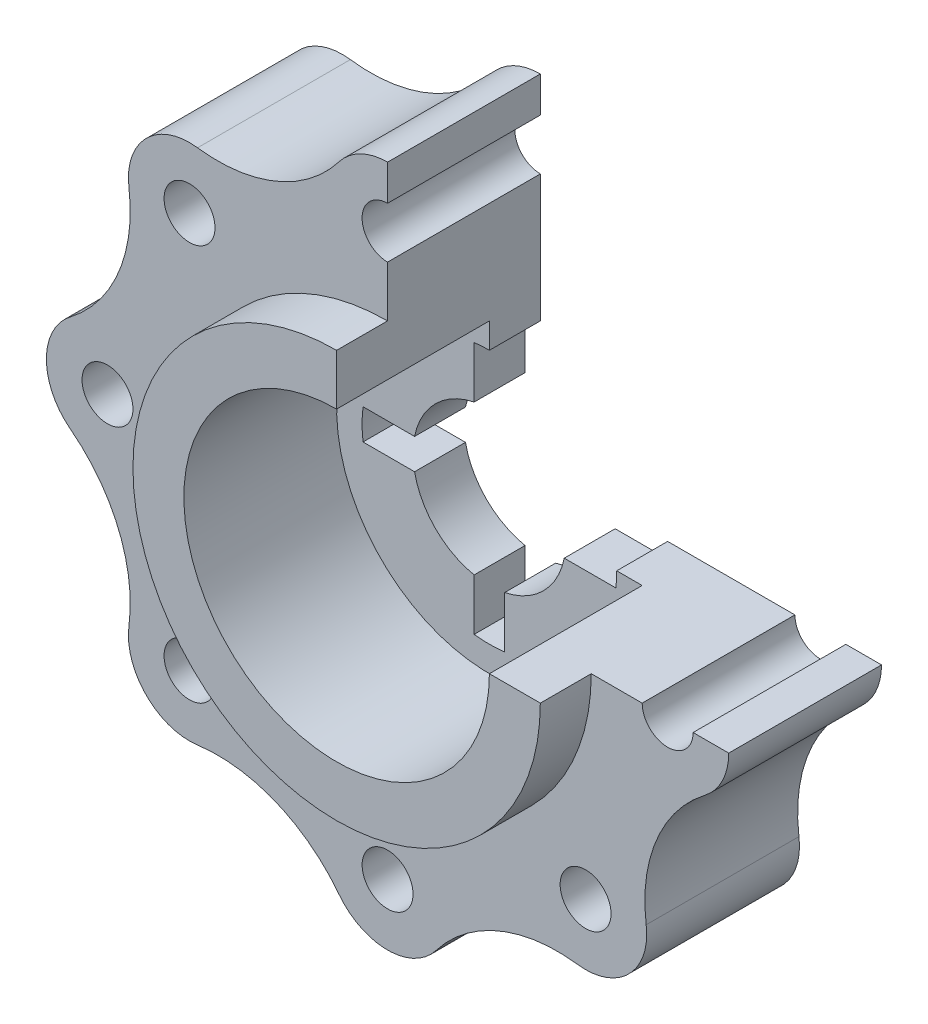
from build123d import *

# Parameters (mm, degrees)
SKETCH2_R           = 5
SKETCH2_R_2         = 40
BOSS_EXTRUDE1_DEPTH = 30
SKETCH2_4_R         = 40
SKETCH2_4_R_2       = 30
BOSS_EXTRUDE2_DEPTH = 40
SKETCH2_5_R         = 30
BOSS_EXTRUDE3_DEPTH = 10
SKETCH3_W           = 75
SKETCH3_H           = 75
CUT_EXTRUDE1_DEPTH  = 40


with BuildPart() as part:
    # Sketch2 → Boss-Extrude1 (new body)
    with BuildSketch(Plane.XY):
        with BuildLine():
            ThreePointArc((-50.786151046, 37.308988209), (-52.807960272, 21.873773346), (-62.292670356, 9.529793233))
            ThreePointArc((-62.292670356, 9.529793233), (-67, 0), (-62.292670356, -9.529793233))
            ThreePointArc((-62.292670356, -9.529793233), (-52.807960272, -21.873773346), (-50.786151046, -37.308988209))
            ThreePointArc((-50.786151046, -37.308988209), (-47.376154339, -47.376154339), (-37.308988209, -50.786151046))
            ThreePointArc((-37.308988209, -50.786151046), (-21.873773346, -52.807960272), (-9.529793233, -62.292670356))
            ThreePointArc((-9.529793233, -62.292670356), (0, -67), (9.529793233, -62.292670356))
            ThreePointArc((9.529793233, -62.292670356), (21.873773346, -52.807960272), (37.308988209, -50.786151046))
            ThreePointArc((37.308988209, -50.786151046), (47.376154339, -47.376154339), (50.786151046, -37.308988209))
            ThreePointArc((50.786151046, -37.308988209), (52.807960272, -21.873773346), (62.292670356, -9.529793233))
            ThreePointArc((62.292670356, -9.529793233), (67, 0), (62.292670356, 9.529793233))
            ThreePointArc((62.292670356, 9.529793233), (52.807960272, 21.873773346), (50.786151046, 37.308988209))
            ThreePointArc((50.786151046, 37.308988209), (47.376154339, 47.376154339), (37.308988209, 50.786151046))
            ThreePointArc((37.308988209, 50.786151046), (21.873773346, 52.807960272), (9.529793233, 62.292670356))
            ThreePointArc((9.529793233, 62.292670356), (0, 67), (-9.529793233, 62.292670356))
            ThreePointArc((-9.529793233, 62.292670356), (-21.873773346, 52.807960272), (-37.308988209, 50.786151046))
            ThreePointArc((-37.308988209, 50.786151046), (-47.376154339, 47.376154339), (-50.786151046, 37.308988209))
        make_face()
        with Locations((-38.890872965, -38.890872965)):
            Circle(SKETCH2_R, mode=Mode.SUBTRACT)
        with Locations((0, -55)):
            Circle(SKETCH2_R, mode=Mode.SUBTRACT)
        with Locations((-55, 0)):
            Circle(SKETCH2_R, mode=Mode.SUBTRACT)
        with Locations((38.890872965, -38.890872965)):
            Circle(SKETCH2_R, mode=Mode.SUBTRACT)
        Circle(SKETCH2_R_2, mode=Mode.SUBTRACT)
        with Locations((55, 0)):
            Circle(SKETCH2_R, mode=Mode.SUBTRACT)
        with Locations((-38.890872965, 38.890872965)):
            Circle(SKETCH2_R, mode=Mode.SUBTRACT)
        with Locations((0, 55)):
            Circle(SKETCH2_R, mode=Mode.SUBTRACT)
        with Locations((38.890872965, 38.890872965)):
            Circle(SKETCH2_R, mode=Mode.SUBTRACT)
    extrude(amount=BOSS_EXTRUDE1_DEPTH)

    # Sketch2<4> → Boss-Extrude2 (add)
    with BuildSketch(Plane.XY):
        Circle(SKETCH2_4_R)
        Circle(SKETCH2_4_R_2, mode=Mode.SUBTRACT)
    extrude(amount=BOSS_EXTRUDE2_DEPTH)

    # Sketch2<5> → Boss-Extrude3 (add)
    with BuildSketch(Plane.XY):
        Circle(SKETCH2_5_R)
        with BuildLine():
            ThreePointArc((-24.819347292, -3), (-25, 0), (-24.819347292, 3))
            Line((-24.819347292, 3), (-14.696938457, 3))
            ThreePointArc((-14.696938457, 3), (-10.606601718, 10.606601718), (-3, 14.696938457))
            Line((-3, 14.696938457), (-3, 24.819347292))
            ThreePointArc((-3, 24.819347292), (0, 25), (3, 24.819347292))
            Line((3, 24.819347292), (3, 14.696938457))
            ThreePointArc((3, 14.696938457), (10.606601718, 10.606601718), (14.696938457, 3))
            Line((14.696938457, 3), (24.819347292, 3))
            ThreePointArc((24.819347292, 3), (25, 0), (24.819347292, -3))
            Line((24.819347292, -3), (14.696938457, -3))
            ThreePointArc((14.696938457, -3), (10.606601718, -10.606601718), (3, -14.696938457))
            Line((3, -14.696938457), (3, -24.819347292))
            ThreePointArc((3, -24.819347292), (0, -25), (-3, -24.819347292))
            Line((-3, -24.819347292), (-3, -14.696938457))
            ThreePointArc((-3, -14.696938457), (-10.606601718, -10.606601718), (-14.696938457, -3))
            Line((-14.696938457, -3), (-24.819347292, -3))
        make_face(mode=Mode.SUBTRACT)
    extrude(amount=BOSS_EXTRUDE3_DEPTH)

    # Sketch3 → Cut-Extrude1 (cut)
    with BuildSketch(Plane.XY):
        with Locations((37.5, 37.5)):
            Rectangle(SKETCH3_W, SKETCH3_H)
    extrude(amount=CUT_EXTRUDE1_DEPTH, mode=Mode.SUBTRACT)


solid = part.part
